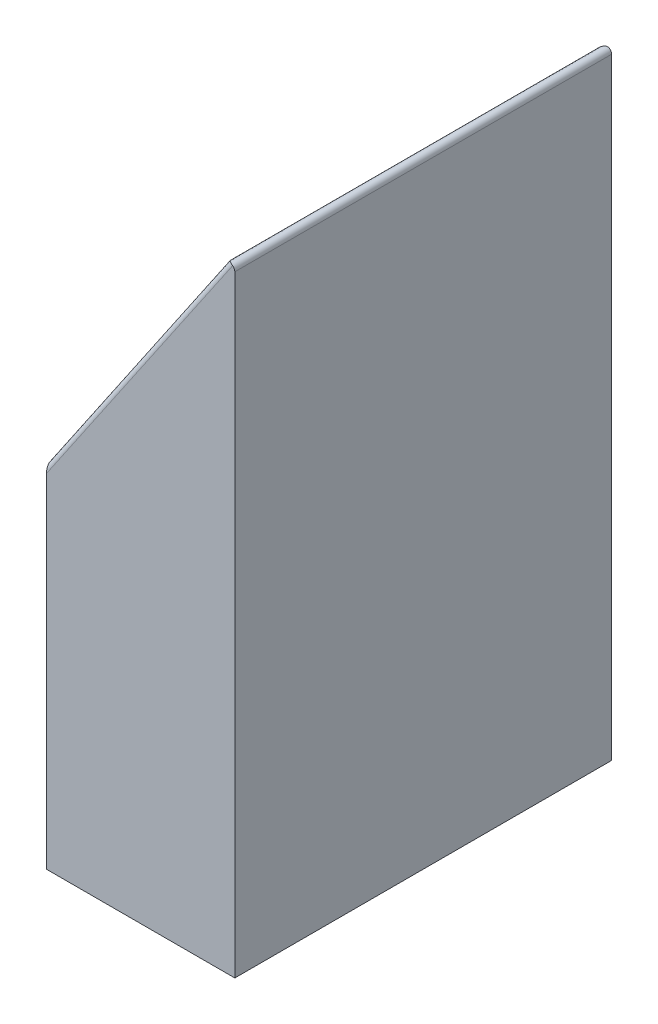
from build123d import *

# Parameters (mm, degrees)
EXTRUDE_1_DEPTH = 300
FILLET_1_R      = 4


with BuildPart() as part:
    # 草圖1 → 填料-伸長1 (new body)
    with BuildSketch(Plane.XY):
        Polygon((0, 0), (-150, -220), (-150, -500), (0, -500), align=None)
    extrude(amount=EXTRUDE_1_DEPTH)

    # 圓角1
    fillet_1_edges = [part.edges().sort_by_distance(p)[0] for p in [
        (-75, -110, 0),
        (-75, -110, 300),
        (-150, -220, 150),
        (0, 0, 150),
    ]]
    fillet(fillet_1_edges, radius=FILLET_1_R)


solid = part.part
